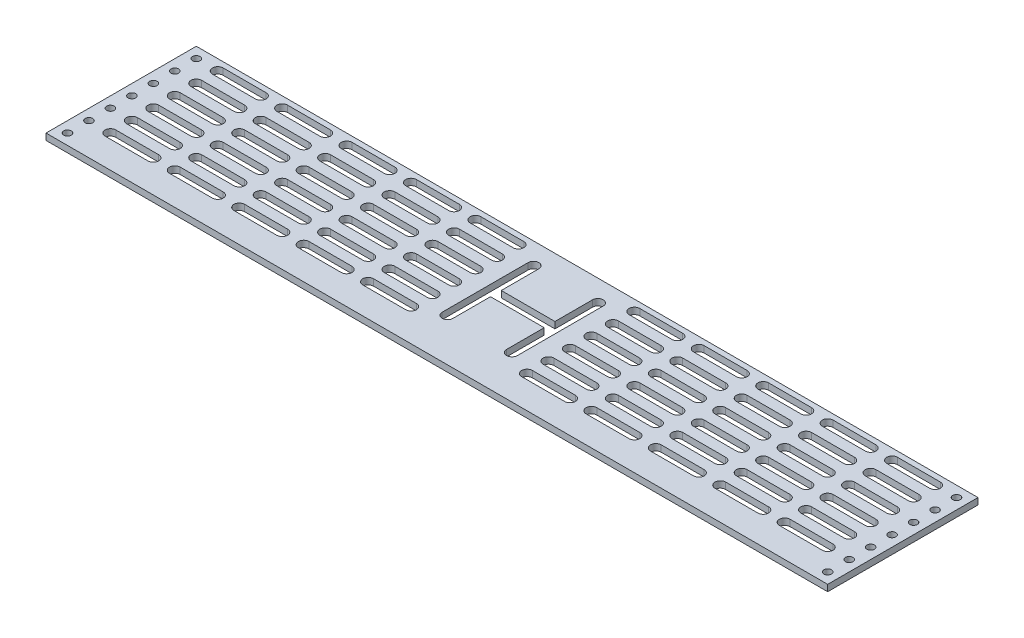
from build123d import *

# Parameters (mm, degrees)
EXTRUDE_1_DEPTH     = 3
SKETCH_2_R          = 1.75
CUT_EXTRUDE_1_DEPTH = 199.829072321
CUT_EXTRUDE_2_DEPTH = 199.829072321
CUT_EXTRUDE_3_DEPTH = 10


with BuildPart() as part:
    # 草图1 → 凸台-拉伸1 (new body)
    with BuildSketch(Plane(origin=(0, 0, 0), x_dir=(1, 0, 0), z_dir=(0, 1, 0))):
        Polygon((0, 0), (-182, 0), (-182, -80), (182, -80), (182, 0), align=None)
    extrude(amount=EXTRUDE_1_DEPTH)

    # 草图2 → 切除-拉伸1 (cut, through all)
    with BuildSketch(Plane(origin=(0, 3, 0), x_dir=(1, 0, 0), z_dir=(0, 1, 0))):
        with BuildLine():
            ThreePointArc((-177, -73.25), (-178.75, -75), (-177, -76.75))
            Line((-177, -76.75), (-177, -75))
            Line((-177, -75), (-177, -73.25))
        make_face()
        with BuildLine():
            Line((-177, -75), (-177, -76.75))
            ThreePointArc((-177, -76.75), (-175.762563133, -76.237436867), (-175.25, -75))
            ThreePointArc((-175.25, -75), (-175.762563133, -73.762563133), (-177, -73.25))
            Line((-177, -73.25), (-177, -75))
        make_face()
        with BuildLine():
            ThreePointArc((-177, -63.25), (-178.75, -65), (-177, -66.75))
            Line((-177, -66.75), (-177, -63.25))
        make_face()
        with BuildLine():
            Line((-177, -63.25), (-177, -66.75))
            ThreePointArc((-177, -66.75), (-175.762563133, -66.237436867), (-175.25, -65))
            ThreePointArc((-175.25, -65), (-175.762563133, -63.762563133), (-177, -63.25))
        make_face()
        with BuildLine():
            ThreePointArc((-177, -53.25), (-178.75, -55), (-177, -56.75))
            Line((-177, -56.75), (-177, -53.25))
        make_face()
        with BuildLine():
            Line((-177, -53.25), (-177, -56.75))
            ThreePointArc((-177, -56.75), (-175.762563133, -56.237436867), (-175.25, -55))
            ThreePointArc((-175.25, -55), (-175.762563133, -53.762563133), (-177, -53.25))
        make_face()
        with BuildLine():
            ThreePointArc((-177, -43.25), (-178.75, -45), (-177, -46.75))
            Line((-177, -46.75), (-177, -43.25))
        make_face()
        with BuildLine():
            Line((-177, -43.25), (-177, -46.75))
            ThreePointArc((-177, -46.75), (-175.762563133, -46.237436867), (-175.25, -45))
            ThreePointArc((-175.25, -45), (-175.762563133, -43.762563133), (-177, -43.25))
        make_face()
        with BuildLine():
            ThreePointArc((-177, -33.25), (-178.75, -35), (-177, -36.75))
            Line((-177, -36.75), (-177, -33.25))
        make_face()
        with BuildLine():
            Line((-177, -33.25), (-177, -36.75))
            ThreePointArc((-177, -36.75), (-175.762563133, -36.237436867), (-175.25, -35))
            ThreePointArc((-175.25, -35), (-175.762563133, -33.762563133), (-177, -33.25))
        make_face()
        with BuildLine():
            ThreePointArc((-177, -23.25), (-178.75, -25), (-177, -26.75))
            Line((-177, -26.75), (-177, -23.25))
        make_face()
        with BuildLine():
            Line((-177, -23.25), (-177, -26.75))
            ThreePointArc((-177, -26.75), (-175.762563133, -26.237436867), (-175.25, -25))
            ThreePointArc((-175.25, -25), (-175.762563133, -23.762563133), (-177, -23.25))
        make_face()
        with BuildLine():
            ThreePointArc((-177, -13.25), (-178.75, -15), (-177, -16.75))
            Line((-177, -16.75), (-177, -13.25))
        make_face()
        with BuildLine():
            Line((-177, -13.25), (-177, -16.75))
            ThreePointArc((-177, -16.75), (-175.762563133, -16.237436867), (-175.25, -15))
            ThreePointArc((-175.25, -15), (-175.762563133, -13.762563133), (-177, -13.25))
        make_face()
        with BuildLine():
            ThreePointArc((-177, -3.25), (-178.75, -5), (-177, -6.75))
            Line((-177, -6.75), (-177, -3.25))
        make_face()
        with BuildLine():
            Line((-177, -3.25), (-177, -6.75))
            ThreePointArc((-177, -6.75), (-175.762563133, -6.237436867), (-175.25, -5))
            ThreePointArc((-175.25, -5), (-175.762563133, -3.762563133), (-177, -3.25))
        make_face()
        with Locations(Location((177, -5, 0), (0, 0, 270))):
            Circle(SKETCH_2_R)
        with Locations(Location((177, -15, 0), (0, 0, 270))):
            Circle(SKETCH_2_R)
        with Locations(Location((177, -25, 0), (0, 0, 270))):
            Circle(SKETCH_2_R)
        with Locations(Location((177, -35, 0), (0, 0, 270))):
            Circle(SKETCH_2_R)
        with Locations(Location((177, -45, 0), (0, 0, 270))):
            Circle(SKETCH_2_R)
        with Locations(Location((177, -55, 0), (0, 0, 270))):
            Circle(SKETCH_2_R)
        with Locations(Location((177, -65, 0), (0, 0, 270))):
            Circle(SKETCH_2_R)
        with Locations(Location((177, -75, 0), (0, 0, 270))):
            Circle(SKETCH_2_R)
    extrude(amount=-CUT_EXTRUDE_1_DEPTH, mode=Mode.SUBTRACT)

    # 草图3 → 切除-拉伸2 (cut, through all)
    with BuildSketch(Plane(origin=(0, 3, 0), x_dir=(1, 0, 0), z_dir=(0, 1, 0))):
        with BuildLine():
            Line((12.5, -37.5), (-12.5, -37.5))
            Line((-12.5, -37.5), (-12.5, -20))
            ThreePointArc((-12.5, -20), (-15, -17.5), (-17.5, -20))
            Line((-17.5, -20), (-17.5, -60))
            ThreePointArc((-17.5, -60), (-15, -62.5), (-12.5, -60))
            Line((-12.5, -60), (-12.5, -42.5))
            Line((-12.5, -42.5), (12.5, -42.5))
            Line((12.5, -42.5), (12.5, -60))
            ThreePointArc((12.5, -60), (15, -62.5), (17.5, -60))
            Line((17.5, -60), (17.5, -20))
            ThreePointArc((17.5, -20), (15, -17.5), (12.5, -20))
            Line((12.5, -20), (12.5, -37.5))
        make_face()
        with BuildLine():
            ThreePointArc((-147, -67.5), (-144.5, -65), (-147, -62.5))
            Line((-147, -62.5), (-167, -62.5))
            ThreePointArc((-167, -62.5), (-169.5, -65), (-167, -67.5))
            Line((-167, -67.5), (-147, -67.5))
        make_face()
        with BuildLine():
            ThreePointArc((-117, -67.5), (-114.5, -65), (-117, -62.5))
            Line((-117, -62.5), (-137, -62.5))
            ThreePointArc((-137, -62.5), (-139.5, -65), (-137, -67.5))
            Line((-137, -67.5), (-117, -67.5))
        make_face()
        with BuildLine():
            Line((-107, -17.5), (-87, -17.5))
            ThreePointArc((-87, -17.5), (-84.5, -15), (-87, -12.5))
            Line((-87, -12.5), (-107, -12.5))
            ThreePointArc((-107, -12.5), (-109.5, -15), (-107, -17.5))
        make_face()
        with BuildLine():
            Line((-107, -27.5), (-87, -27.5))
            ThreePointArc((-87, -27.5), (-84.5, -25), (-87, -22.5))
            Line((-87, -22.5), (-107, -22.5))
            ThreePointArc((-107, -22.5), (-109.5, -25), (-107, -27.5))
        make_face()
        with BuildLine():
            Line((-107, -37.5), (-87, -37.5))
            ThreePointArc((-87, -37.5), (-84.5, -35), (-87, -32.5))
            Line((-87, -32.5), (-107, -32.5))
            ThreePointArc((-107, -32.5), (-109.5, -35), (-107, -37.5))
        make_face()
        with BuildLine():
            Line((-107, -47.5), (-87, -47.5))
            ThreePointArc((-87, -47.5), (-84.5, -45), (-87, -42.5))
            Line((-87, -42.5), (-107, -42.5))
            ThreePointArc((-107, -42.5), (-109.5, -45), (-107, -47.5))
        make_face()
        with BuildLine():
            Line((-107, -57.5), (-87, -57.5))
            ThreePointArc((-87, -57.5), (-84.5, -55), (-87, -52.5))
            Line((-87, -52.5), (-107, -52.5))
            ThreePointArc((-107, -52.5), (-109.5, -55), (-107, -57.5))
        make_face()
        with BuildLine():
            ThreePointArc((-47, -62.5), (-48.767766953, -63.232233047), (-49.5, -65))
            ThreePointArc((-49.5, -65), (-48.767766953, -66.767766953), (-47, -67.5))
            Line((-47, -67.5), (-27, -67.5))
            ThreePointArc((-27, -67.5), (-24.5, -65), (-27, -62.5))
            Line((-27, -62.5), (-47, -62.5))
        make_face()
        with BuildLine():
            ThreePointArc((-77, -62.5), (-79.5, -65), (-77, -67.5))
            Line((-77, -67.5), (-57, -67.5))
            ThreePointArc((-57, -67.5), (-54.5, -65), (-57, -62.5))
            Line((-57, -62.5), (-77, -62.5))
        make_face()
        with BuildLine():
            Line((-107, -67.5), (-87, -67.5))
            ThreePointArc((-87, -67.5), (-84.5, -65), (-87, -62.5))
            Line((-87, -62.5), (-107, -62.5))
            ThreePointArc((-107, -62.5), (-109.5, -65), (-107, -67.5))
        make_face()
        with BuildLine():
            ThreePointArc((-167, -52.5), (-169.5, -55), (-167, -57.5))
            Line((-167, -57.5), (-147, -57.5))
            ThreePointArc((-147, -57.5), (-144.5, -55), (-147, -52.5))
            Line((-147, -52.5), (-167, -52.5))
        make_face()
        with BuildLine():
            ThreePointArc((-137, -52.5), (-139.5, -55), (-137, -57.5))
            Line((-137, -57.5), (-117, -57.5))
            ThreePointArc((-117, -57.5), (-114.5, -55), (-117, -52.5))
            Line((-117, -52.5), (-137, -52.5))
        make_face()
        with BuildLine():
            ThreePointArc((-77, -52.5), (-79.5, -55), (-77, -57.5))
            Line((-77, -57.5), (-57, -57.5))
            ThreePointArc((-57, -57.5), (-54.5, -55), (-57, -52.5))
            Line((-57, -52.5), (-77, -52.5))
        make_face()
        with BuildLine():
            ThreePointArc((-167, -42.5), (-169.5, -45), (-167, -47.5))
            Line((-167, -47.5), (-147, -47.5))
            ThreePointArc((-147, -47.5), (-144.5, -45), (-147, -42.5))
            Line((-147, -42.5), (-167, -42.5))
        make_face()
        with BuildLine():
            ThreePointArc((-137, -42.5), (-139.5, -45), (-137, -47.5))
            Line((-137, -47.5), (-117, -47.5))
            ThreePointArc((-117, -47.5), (-114.5, -45), (-117, -42.5))
            Line((-117, -42.5), (-137, -42.5))
        make_face()
        with BuildLine():
            ThreePointArc((-77, -42.5), (-79.5, -45), (-77, -47.5))
            Line((-77, -47.5), (-57, -47.5))
            ThreePointArc((-57, -47.5), (-54.5, -45), (-57, -42.5))
            Line((-57, -42.5), (-77, -42.5))
        make_face()
        with BuildLine():
            ThreePointArc((-167, -32.5), (-169.5, -35), (-167, -37.5))
            Line((-167, -37.5), (-147, -37.5))
            ThreePointArc((-147, -37.5), (-144.5, -35), (-147, -32.5))
            Line((-147, -32.5), (-167, -32.5))
        make_face()
        with BuildLine():
            ThreePointArc((-137, -32.5), (-139.5, -35), (-137, -37.5))
            Line((-137, -37.5), (-117, -37.5))
            ThreePointArc((-117, -37.5), (-114.5, -35), (-117, -32.5))
            Line((-117, -32.5), (-137, -32.5))
        make_face()
        with BuildLine():
            ThreePointArc((-77, -32.5), (-79.5, -35), (-77, -37.5))
            Line((-77, -37.5), (-57, -37.5))
            ThreePointArc((-57, -37.5), (-54.5, -35), (-57, -32.5))
            Line((-57, -32.5), (-77, -32.5))
        make_face()
        with BuildLine():
            ThreePointArc((-167, -22.5), (-169.5, -25), (-167, -27.5))
            Line((-167, -27.5), (-147, -27.5))
            ThreePointArc((-147, -27.5), (-144.5, -25), (-147, -22.5))
            Line((-147, -22.5), (-167, -22.5))
        make_face()
        with BuildLine():
            ThreePointArc((-137, -22.5), (-139.5, -25), (-137, -27.5))
            Line((-137, -27.5), (-117, -27.5))
            ThreePointArc((-117, -27.5), (-114.5, -25), (-117, -22.5))
            Line((-117, -22.5), (-137, -22.5))
        make_face()
        with BuildLine():
            ThreePointArc((-77, -22.5), (-79.5, -25), (-77, -27.5))
            Line((-77, -27.5), (-57, -27.5))
            ThreePointArc((-57, -27.5), (-54.5, -25), (-57, -22.5))
            Line((-57, -22.5), (-77, -22.5))
        make_face()
        with BuildLine():
            ThreePointArc((-167, -12.5), (-169.5, -15), (-167, -17.5))
            Line((-167, -17.5), (-147, -17.5))
            ThreePointArc((-147, -17.5), (-144.5, -15), (-147, -12.5))
            Line((-147, -12.5), (-167, -12.5))
        make_face()
        with BuildLine():
            ThreePointArc((-137, -12.5), (-139.5, -15), (-137, -17.5))
            Line((-137, -17.5), (-117, -17.5))
            ThreePointArc((-117, -17.5), (-114.5, -15), (-117, -12.5))
            Line((-117, -12.5), (-137, -12.5))
        make_face()
        with BuildLine():
            ThreePointArc((-77, -12.5), (-79.5, -15), (-77, -17.5))
            Line((-77, -17.5), (-57, -17.5))
            ThreePointArc((-57, -17.5), (-54.5, -15), (-57, -12.5))
            Line((-57, -12.5), (-77, -12.5))
        make_face()
        with BuildLine():
            Line((87, -67.5), (107, -67.5))
            ThreePointArc((107, -67.5), (109.5, -65), (107, -62.5))
            Line((107, -62.5), (87, -62.5))
            ThreePointArc((87, -62.5), (84.5, -65), (87, -67.5))
        make_face()
        with BuildLine():
            ThreePointArc((77, -67.5), (78.767766953, -66.767766953), (79.5, -65))
            ThreePointArc((79.5, -65), (78.767766953, -63.232233047), (77, -62.5))
            Line((77, -62.5), (57, -62.5))
            ThreePointArc((57, -62.5), (54.5, -65), (57, -67.5))
            Line((57, -67.5), (77, -67.5))
        make_face()
        with BuildLine():
            ThreePointArc((147, -62.5), (145.232233047, -63.232233047), (144.5, -65))
            ThreePointArc((144.5, -65), (145.232233047, -66.767766953), (147, -67.5))
            Line((147, -67.5), (167, -67.5))
            ThreePointArc((167, -67.5), (169.5, -65), (167, -62.5))
            Line((167, -62.5), (147, -62.5))
        make_face()
        with BuildLine():
            ThreePointArc((117, -62.5), (114.5, -65), (117, -67.5))
            Line((117, -67.5), (137, -67.5))
            ThreePointArc((137, -67.5), (139.5, -65), (137, -62.5))
            Line((137, -62.5), (117, -62.5))
        make_face()
        with BuildLine():
            ThreePointArc((77, -17.5), (79.5, -15), (77, -12.5))
            Line((77, -12.5), (57, -12.5))
            ThreePointArc((57, -12.5), (54.5, -15), (57, -17.5))
            Line((57, -17.5), (77, -17.5))
        make_face()
        with BuildLine():
            ThreePointArc((107, -17.5), (109.5, -15), (107, -12.5))
            Line((107, -12.5), (87, -12.5))
            ThreePointArc((87, -12.5), (84.5, -15), (87, -17.5))
            Line((87, -17.5), (107, -17.5))
        make_face()
        with BuildLine():
            ThreePointArc((137, -17.5), (139.5, -15), (137, -12.5))
            Line((137, -12.5), (117, -12.5))
            ThreePointArc((117, -12.5), (114.5, -15), (117, -17.5))
            Line((117, -17.5), (137, -17.5))
        make_face()
        with BuildLine():
            ThreePointArc((77, -27.5), (79.5, -25), (77, -22.5))
            Line((77, -22.5), (57, -22.5))
            ThreePointArc((57, -22.5), (54.5, -25), (57, -27.5))
            Line((57, -27.5), (77, -27.5))
        make_face()
        with BuildLine():
            ThreePointArc((107, -27.5), (109.5, -25), (107, -22.5))
            Line((107, -22.5), (87, -22.5))
            ThreePointArc((87, -22.5), (84.5, -25), (87, -27.5))
            Line((87, -27.5), (107, -27.5))
        make_face()
        with BuildLine():
            ThreePointArc((137, -27.5), (139.5, -25), (137, -22.5))
            Line((137, -22.5), (117, -22.5))
            ThreePointArc((117, -22.5), (114.5, -25), (117, -27.5))
            Line((117, -27.5), (137, -27.5))
        make_face()
        with BuildLine():
            ThreePointArc((77, -37.5), (79.5, -35), (77, -32.5))
            Line((77, -32.5), (57, -32.5))
            ThreePointArc((57, -32.5), (54.5, -35), (57, -37.5))
            Line((57, -37.5), (77, -37.5))
        make_face()
        with BuildLine():
            ThreePointArc((107, -37.5), (109.5, -35), (107, -32.5))
            Line((107, -32.5), (87, -32.5))
            ThreePointArc((87, -32.5), (84.5, -35), (87, -37.5))
            Line((87, -37.5), (107, -37.5))
        make_face()
        with BuildLine():
            ThreePointArc((137, -37.5), (139.5, -35), (137, -32.5))
            Line((137, -32.5), (117, -32.5))
            ThreePointArc((117, -32.5), (114.5, -35), (117, -37.5))
            Line((117, -37.5), (137, -37.5))
        make_face()
        with BuildLine():
            ThreePointArc((167, -37.5), (169.5, -35), (167, -32.5))
            Line((167, -32.5), (147, -32.5))
            ThreePointArc((147, -32.5), (144.5, -35), (147, -37.5))
            Line((147, -37.5), (167, -37.5))
        make_face()
        with BuildLine():
            ThreePointArc((77, -47.5), (79.5, -45), (77, -42.5))
            Line((77, -42.5), (57, -42.5))
            ThreePointArc((57, -42.5), (54.5, -45), (57, -47.5))
            Line((57, -47.5), (77, -47.5))
        make_face()
        with BuildLine():
            ThreePointArc((107, -47.5), (109.5, -45), (107, -42.5))
            Line((107, -42.5), (87, -42.5))
            ThreePointArc((87, -42.5), (84.5, -45), (87, -47.5))
            Line((87, -47.5), (107, -47.5))
        make_face()
        with BuildLine():
            ThreePointArc((137, -47.5), (139.5, -45), (137, -42.5))
            Line((137, -42.5), (117, -42.5))
            ThreePointArc((117, -42.5), (114.5, -45), (117, -47.5))
            Line((117, -47.5), (137, -47.5))
        make_face()
        with BuildLine():
            ThreePointArc((167, -47.5), (169.5, -45), (167, -42.5))
            Line((167, -42.5), (147, -42.5))
            ThreePointArc((147, -42.5), (144.5, -45), (147, -47.5))
            Line((147, -47.5), (167, -47.5))
        make_face()
        with BuildLine():
            ThreePointArc((77, -57.5), (79.5, -55), (77, -52.5))
            Line((77, -52.5), (57, -52.5))
            ThreePointArc((57, -52.5), (54.5, -55), (57, -57.5))
            Line((57, -57.5), (77, -57.5))
        make_face()
        with BuildLine():
            ThreePointArc((107, -57.5), (109.5, -55), (107, -52.5))
            Line((107, -52.5), (87, -52.5))
            ThreePointArc((87, -52.5), (84.5, -55), (87, -57.5))
            Line((87, -57.5), (107, -57.5))
        make_face()
        with BuildLine():
            ThreePointArc((137, -57.5), (139.5, -55), (137, -52.5))
            Line((137, -52.5), (117, -52.5))
            ThreePointArc((117, -52.5), (114.5, -55), (117, -57.5))
            Line((117, -57.5), (137, -57.5))
        make_face()
        with BuildLine():
            ThreePointArc((167, -57.5), (169.5, -55), (167, -52.5))
            Line((167, -52.5), (147, -52.5))
            ThreePointArc((147, -52.5), (144.5, -55), (147, -57.5))
            Line((147, -57.5), (167, -57.5))
        make_face()
        with BuildLine():
            ThreePointArc((167, -27.5), (169.5, -25), (167, -22.5))
            Line((167, -22.5), (147, -22.5))
            ThreePointArc((147, -22.5), (144.5, -25), (147, -27.5))
            Line((147, -27.5), (167, -27.5))
        make_face()
        with BuildLine():
            ThreePointArc((167, -17.5), (169.5, -15), (167, -12.5))
            Line((167, -12.5), (147, -12.5))
            ThreePointArc((147, -12.5), (144.5, -15), (147, -17.5))
            Line((147, -17.5), (167, -17.5))
        make_face()
        with BuildLine():
            ThreePointArc((-47, -52.5), (-49.5, -55), (-47, -57.5))
            Line((-47, -57.5), (-27, -57.5))
            ThreePointArc((-27, -57.5), (-24.5, -55), (-27, -52.5))
            Line((-27, -52.5), (-47, -52.5))
        make_face()
        with BuildLine():
            ThreePointArc((-47, -42.5), (-49.5, -45), (-47, -47.5))
            Line((-47, -47.5), (-27, -47.5))
            ThreePointArc((-27, -47.5), (-24.5, -45), (-27, -42.5))
            Line((-27, -42.5), (-47, -42.5))
        make_face()
        with BuildLine():
            ThreePointArc((-47, -32.5), (-49.5, -35), (-47, -37.5))
            Line((-47, -37.5), (-27, -37.5))
            ThreePointArc((-27, -37.5), (-24.5, -35), (-27, -32.5))
            Line((-27, -32.5), (-47, -32.5))
        make_face()
        with BuildLine():
            ThreePointArc((-47, -22.5), (-49.5, -25), (-47, -27.5))
            Line((-47, -27.5), (-27, -27.5))
            ThreePointArc((-27, -27.5), (-24.5, -25), (-27, -22.5))
            Line((-27, -22.5), (-47, -22.5))
        make_face()
        with BuildLine():
            ThreePointArc((-47, -12.5), (-49.5, -15), (-47, -17.5))
            Line((-47, -17.5), (-27, -17.5))
            ThreePointArc((-27, -17.5), (-24.5, -15), (-27, -12.5))
            Line((-27, -12.5), (-47, -12.5))
        make_face()
        with BuildLine():
            ThreePointArc((47, -17.5), (49.5, -15), (47, -12.5))
            Line((47, -12.5), (27, -12.5))
            ThreePointArc((27, -12.5), (24.5, -15), (27, -17.5))
            Line((27, -17.5), (47, -17.5))
        make_face()
        with BuildLine():
            ThreePointArc((47, -27.5), (49.5, -25), (47, -22.5))
            Line((47, -22.5), (27, -22.5))
            ThreePointArc((27, -22.5), (24.5, -25), (27, -27.5))
            Line((27, -27.5), (47, -27.5))
        make_face()
        with BuildLine():
            ThreePointArc((47, -37.5), (49.5, -35), (47, -32.5))
            Line((47, -32.5), (27, -32.5))
            ThreePointArc((27, -32.5), (24.5, -35), (27, -37.5))
            Line((27, -37.5), (47, -37.5))
        make_face()
        with BuildLine():
            ThreePointArc((47, -47.5), (49.5, -45), (47, -42.5))
            Line((47, -42.5), (27, -42.5))
            ThreePointArc((27, -42.5), (24.5, -45), (27, -47.5))
            Line((27, -47.5), (47, -47.5))
        make_face()
        with BuildLine():
            ThreePointArc((47, -57.5), (49.5, -55), (47, -52.5))
            Line((47, -52.5), (27, -52.5))
            ThreePointArc((27, -52.5), (24.5, -55), (27, -57.5))
            Line((27, -57.5), (47, -57.5))
        make_face()
        with BuildLine():
            ThreePointArc((47, -67.5), (49.5, -65), (47, -62.5))
            Line((47, -62.5), (27, -62.5))
            ThreePointArc((27, -62.5), (24.5, -65), (27, -67.5))
            Line((27, -67.5), (47, -67.5))
        make_face()
    extrude(amount=-CUT_EXTRUDE_2_DEPTH, mode=Mode.SUBTRACT)

    # 草图4 → 切除-拉伸3 (cut)
    with BuildSketch(Plane.XZ):
        Polygon((182.116628746, 10), (177, 10), (-182, 10), (-182, 0), (182, 0), align=None)
    extrude(amount=-CUT_EXTRUDE_3_DEPTH, mode=Mode.SUBTRACT)


solid = part.part
